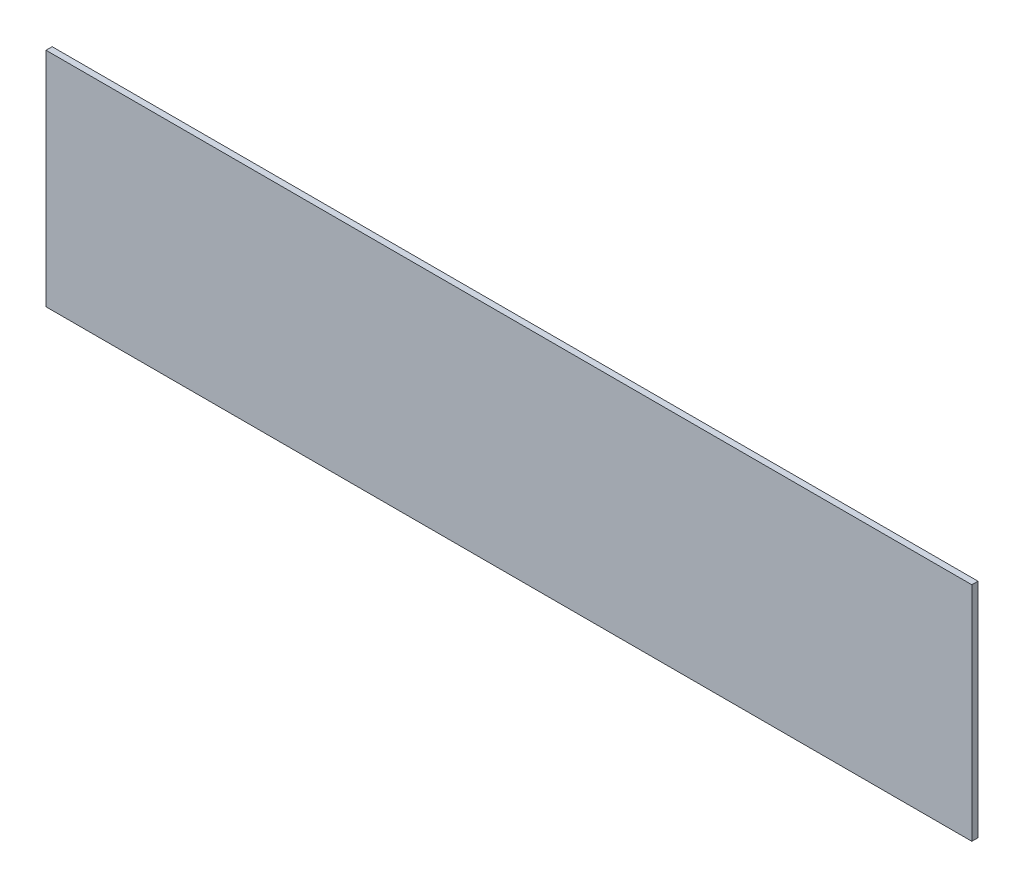
from build123d import *

# Parameters (mm, degrees)
SKETCH1_W           = 476.25
SKETCH1_H           = 114.3
BOSS_EXTRUDE1_DEPTH = 3.175


with BuildPart() as part:
    # Sketch1 → Boss-Extrude1 (new body)
    with BuildSketch(Plane.XY):
        with Locations((147.763757086, -3.810372829)):
            Rectangle(SKETCH1_W, SKETCH1_H)
    extrude(amount=BOSS_EXTRUDE1_DEPTH)


solid = part.part
